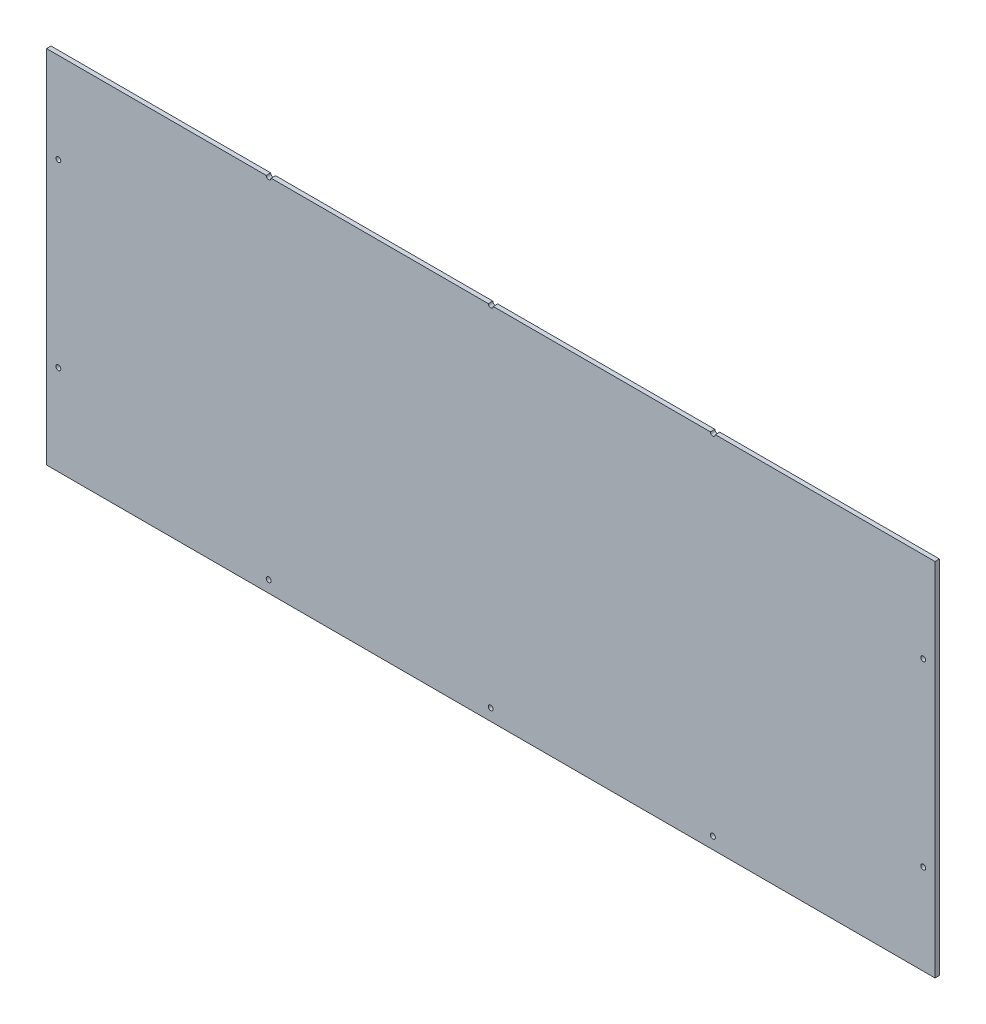
from build123d import *

# Parameters (mm, degrees)
SKETCH2_R           = 2.5
BOSS_EXTRUDE1_DEPTH = 4.5


with BuildPart() as part:
    # Sketch2 → Boss-Extrude1 (new body)
    with BuildSketch(Plane.XY):
        with BuildLine():
            Line((2.5, 183.5), (223.5, 183.5))
            ThreePointArc((223.5, 183.5), (226, 181), (228.5, 183.5))
            Line((228.5, 183.5), (452, 183.5))
            Line((452, 183.5), (452, -183.5))
            Line((452, -183.5), (-452, -183.5))
            Line((-452, -183.5), (-452, 183.5))
            Line((-452, 183.5), (-228.5, 183.5))
            ThreePointArc((-228.5, 183.5), (-226, 181), (-223.5, 183.5))
            Line((-223.5, 183.5), (-2.5, 183.5))
            ThreePointArc((-2.5, 183.5), (0, 181), (2.5, 183.5))
        make_face()
        with Locations((0, -171.5)):
            Circle(SKETCH2_R, mode=Mode.SUBTRACT)
        with Locations((226, -171.5)):
            Circle(SKETCH2_R, mode=Mode.SUBTRACT)
        with Locations((-226, -171.5)):
            Circle(SKETCH2_R, mode=Mode.SUBTRACT)
        with Locations((-440, 91.75)):
            Circle(SKETCH2_R, mode=Mode.SUBTRACT)
        with Locations((-440, -91.75)):
            Circle(SKETCH2_R, mode=Mode.SUBTRACT)
        with Locations(Location((440, -91.75, 0), (0, 0, 180))):
            Circle(SKETCH2_R, mode=Mode.SUBTRACT)
        with Locations(Location((440, 91.75, 0), (0, 0, 180))):
            Circle(SKETCH2_R, mode=Mode.SUBTRACT)
    extrude(amount=BOSS_EXTRUDE1_DEPTH)


solid = part.part
